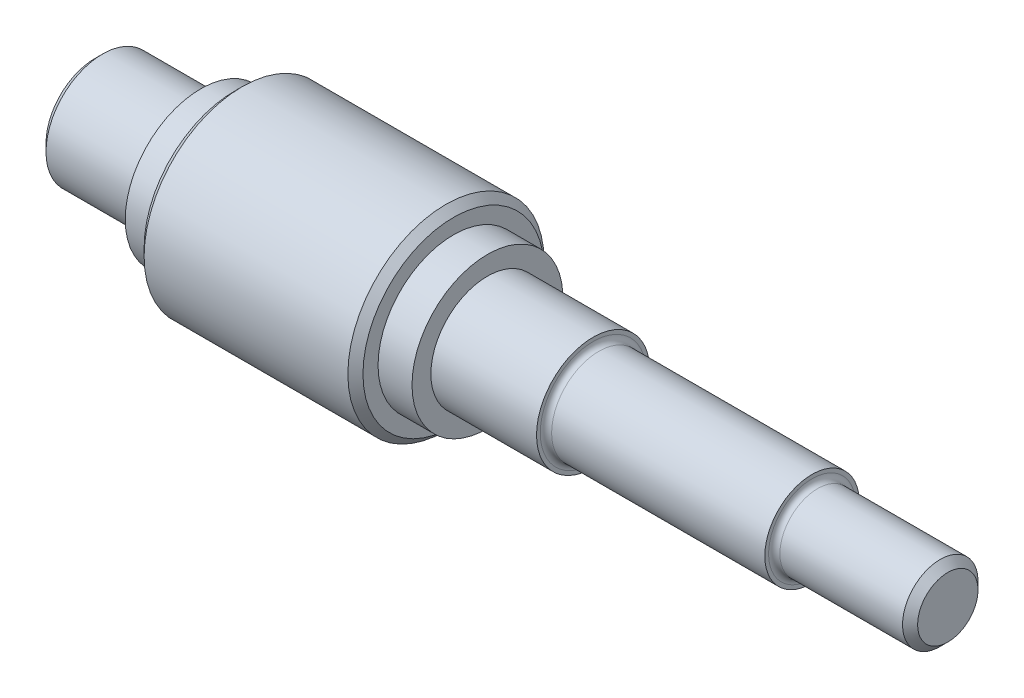
from build123d import *

# Parameters (mm, degrees)
CUT_EXTRUDE_1_DEPTH = 3.5


with BuildPart() as part:
    # 草图1 → 旋转1 (revolve)
    with BuildSketch(Plane.XY, mode=Mode.PRIVATE) as revolve_1_sk:
        with BuildLine():
            Line((-108.930747922, 0), (-108.930747922, 13))
            Line((-108.930747922, 13), (-106.930747922, 15))
            Line((-106.930747922, 15), (-80.930747922, 15))
            Line((-80.930747922, 15), (-80.930747922, 20))
            Line((-80.930747922, 20), (-71.930747922, 20))
            Line((-71.930747922, 20), (-71.930747922, 24))
            Line((-71.930747922, 24), (-69.930747922, 26))
            Line((-69.930747922, 26), (-15.930747922, 26))
            Line((-15.930747922, 26), (-13.930747922, 24))
            Line((-13.930747922, 24), (-13.930747922, 20))
            Line((-13.930747922, 20), (-4.930747922, 20))
            Line((-4.930747922, 20), (-4.930747922, 15))
            Line((-4.930747922, 15), (23.069252078, 15))
            Line((23.069252078, 15), (23.069252078, 14))
            ThreePointArc((23.069252078, 14), (23.508591906, 12.939339828), (24.569252078, 12.5))
            Line((24.569252078, 12.5), (81.069252078, 12.5))
            Line((81.069252078, 12.5), (81.069252078, 11.5))
            ThreePointArc((81.069252078, 11.5), (81.508591906, 10.439339828), (82.569252078, 10))
            Line((82.569252078, 10), (115.069252078, 10))
            Line((115.069252078, 10), (117.069252078, 8))
            Line((117.069252078, 8), (117.069252078, 0))
            Line((117.069252078, 0), (-108.930747922, 0))
        make_face()
    revolve(revolve_1_sk.sketch.rotate(Axis((-108.930747922, 0, 0), (1, 0, 0)), 90), axis=Axis((-108.930747922, 0, 0), (1, 0, 0)))

    # 草图2 → 切除-拉伸1 (cut)
    with BuildSketch(Plane(origin=(0, 0, -10), x_dir=(-1, 0, 0), z_dir=(0, 0, -1))):
        with BuildLine():
            Line((-110.808670822, 3), (-88.808670822, 3))
            ThreePointArc((-88.808670822, 3), (-85.808670822, 0), (-88.808670822, -3))
            Line((-88.808670822, -3), (-110.808670822, -3))
            ThreePointArc((-110.808670822, -3), (-113.808670822, 0), (-110.808670822, 3))
        make_face()
    extrude(amount=-CUT_EXTRUDE_1_DEPTH, mode=Mode.SUBTRACT)


solid = part.part
